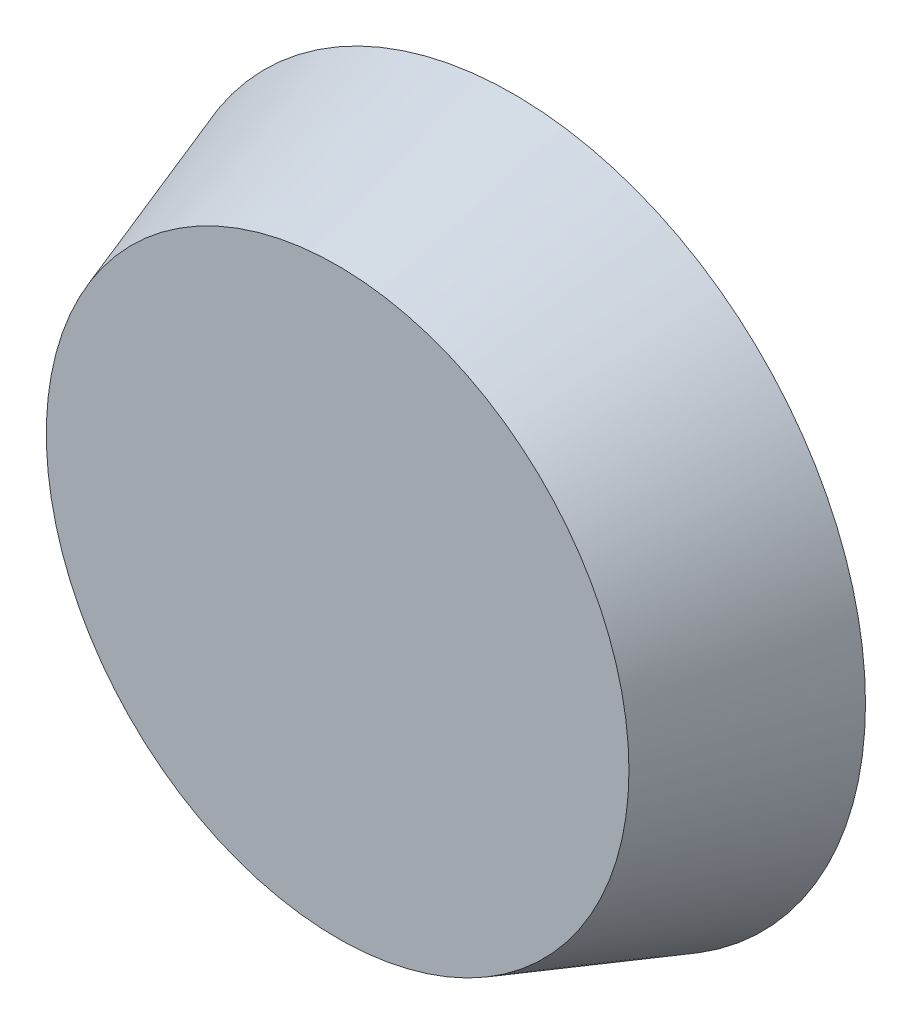
from build123d import *

# Parameters (mm, degrees)
IZIM1_R                     = 2
IZIM1_R_2                   = 1
EKSTR_ZYON_NCE1_DEPTH       = 1
EKSTR_ZYON_NCE1_DRAFT       = 19
IZIM2_R                     = 1.655672387
Y_KSEKLIK_EKSTR_ZYON1_DEPTH = 0.1


with BuildPart() as part:
    # Çizim1 → Ekstrüzyon-İnce1 (with draft: the straight prism first)
    with BuildSketch(Plane.XY):
        Circle(IZIM1_R)
        Circle(IZIM1_R_2, mode=Mode.SUBTRACT)
    extrude(amount=EKSTR_ZYON_NCE1_DEPTH)
    # Ekstrüzyon-İnce1: the draft: its side faces are tilted about the plane it starts from
    ekstr_zyon_nce1_sides = [part.faces().sort_by_distance(p)[0] for p in [
        (-2, 0, 0.5),
        (-1, 0, 0.5),
    ]]
    draft(ekstr_zyon_nce1_sides, Plane.XY, EKSTR_ZYON_NCE1_DRAFT)

    # Çizim2 → Yükseklik-Ekstrüzyon1 (add)
    with BuildSketch(Plane.XY.offset(1)):
        Circle(IZIM2_R)
    extrude(amount=-Y_KSEKLIK_EKSTR_ZYON1_DEPTH)


solid = part.part
